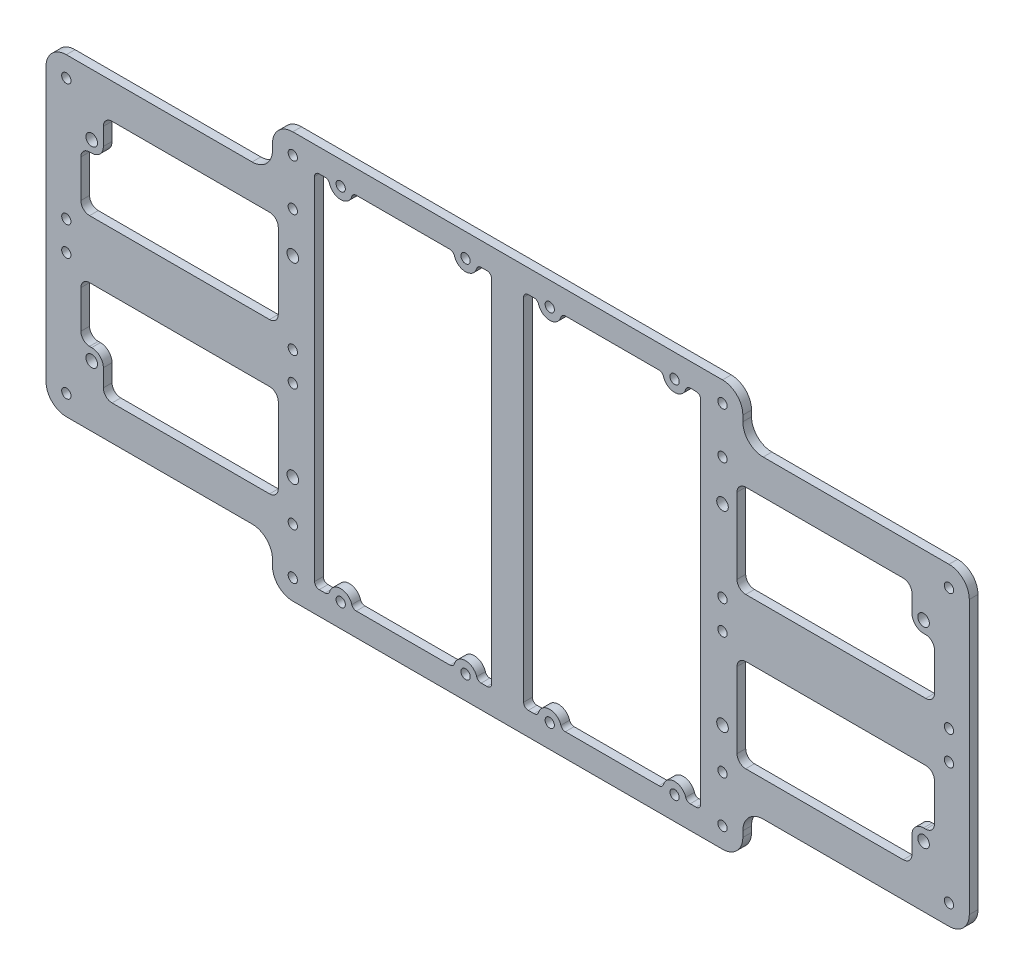
from build123d import *

# Parameters (mm, degrees)
MODEL_R             = 1.6
MODEL_R_2           = 2
BOSS_EXTRUDE1_DEPTH = 3


with BuildPart() as part:
    # Model → Boss-Extrude1 (new body)
    with BuildSketch(Plane.XY):
        with BuildLine():
            Line((-159, -47), (-159, 47))
            ThreePointArc((-159, 47), (-156.949747468, 51.949747468), (-152, 54))
            Line((-152, 54), (-88, 54))
            ThreePointArc((-88, 54), (-83.050252532, 56.050252532), (-81, 61))
            Line((-81, 61), (-81, 63))
            ThreePointArc((-81, 63), (-78.949747468, 67.949747468), (-74, 70))
            Line((-74, 70), (74, 70))
            ThreePointArc((74, 70), (78.949747468, 67.949747468), (81, 63))
            Line((81, 63), (81, 61))
            ThreePointArc((81, 61), (83.050252532, 56.050252532), (88, 54))
            Line((88, 54), (152, 54))
            ThreePointArc((152, 54), (156.949747468, 51.949747468), (159, 47))
            Line((159, 47), (159, -47))
            ThreePointArc((159, -47), (156.949747468, -51.949747468), (152, -54))
            Line((152, -54), (88, -54))
            ThreePointArc((88, -54), (83.050252532, -56.050252532), (81, -61))
            Line((81, -61), (81, -63))
            ThreePointArc((81, -63), (78.949747468, -67.949747468), (74, -70))
            Line((74, -70), (-74, -70))
            ThreePointArc((-74, -70), (-78.949747468, -67.949747468), (-81, -63))
            Line((-81, -63), (-81, -61))
            ThreePointArc((-81, -61), (-83.050252532, -56.050252532), (-88, -54))
            Line((-88, -54), (-152, -54))
            ThreePointArc((-152, -54), (-156.949747468, -51.949747468), (-159, -47))
        make_face()
        with Locations((-57.5, 62)):
            Circle(MODEL_R, mode=Mode.SUBTRACT)
        with Locations((-14.5, 62)):
            Circle(MODEL_R, mode=Mode.SUBTRACT)
        with Locations((-57.5, -62)):
            Circle(MODEL_R, mode=Mode.SUBTRACT)
        with Locations((-14.5, -62)):
            Circle(MODEL_R, mode=Mode.SUBTRACT)
        with Locations((14.5, 62)):
            Circle(MODEL_R, mode=Mode.SUBTRACT)
        with Locations((57.5, 62)):
            Circle(MODEL_R, mode=Mode.SUBTRACT)
        with Locations((14.5, -62)):
            Circle(MODEL_R, mode=Mode.SUBTRACT)
        with Locations((57.5, -62)):
            Circle(MODEL_R, mode=Mode.SUBTRACT)
        with Locations((-152, -47)):
            Circle(MODEL_R, mode=Mode.SUBTRACT)
        with Locations((-152, -5)):
            Circle(MODEL_R, mode=Mode.SUBTRACT)
        with Locations((-74, -47)):
            Circle(MODEL_R, mode=Mode.SUBTRACT)
        with Locations((-74, -5)):
            Circle(MODEL_R, mode=Mode.SUBTRACT)
        with Locations((-152, 47)):
            Circle(MODEL_R, mode=Mode.SUBTRACT)
        with Locations((-152, 5)):
            Circle(MODEL_R, mode=Mode.SUBTRACT)
        with Locations((-74, 47)):
            Circle(MODEL_R, mode=Mode.SUBTRACT)
        with Locations((-74, 5)):
            Circle(MODEL_R, mode=Mode.SUBTRACT)
        with Locations((152, -47)):
            Circle(MODEL_R, mode=Mode.SUBTRACT)
        with Locations((152, -5)):
            Circle(MODEL_R, mode=Mode.SUBTRACT)
        with Locations((74, -47)):
            Circle(MODEL_R, mode=Mode.SUBTRACT)
        with Locations((74, -5)):
            Circle(MODEL_R, mode=Mode.SUBTRACT)
        with Locations((74, 5)):
            Circle(MODEL_R, mode=Mode.SUBTRACT)
        with Locations((152, 47)):
            Circle(MODEL_R, mode=Mode.SUBTRACT)
        with Locations((152, 5)):
            Circle(MODEL_R, mode=Mode.SUBTRACT)
        with Locations((74, 47)):
            Circle(MODEL_R, mode=Mode.SUBTRACT)
        with Locations((-74, 33)):
            Circle(MODEL_R_2, mode=Mode.SUBTRACT)
        with Locations((-74, -33)):
            Circle(MODEL_R_2, mode=Mode.SUBTRACT)
        with Locations((74, 33)):
            Circle(MODEL_R_2, mode=Mode.SUBTRACT)
        with Locations((74, -33)):
            Circle(MODEL_R_2, mode=Mode.SUBTRACT)
        with Locations((-143.25, 33)):
            Circle(MODEL_R_2, mode=Mode.SUBTRACT)
        with Locations((-143.25, -33)):
            Circle(MODEL_R_2, mode=Mode.SUBTRACT)
        with Locations((143.25, 33)):
            Circle(MODEL_R_2, mode=Mode.SUBTRACT)
        with Locations((143.25, -33)):
            Circle(MODEL_R_2, mode=Mode.SUBTRACT)
        with Locations((-74, 63)):
            Circle(MODEL_R, mode=Mode.SUBTRACT)
        with Locations((74, 63)):
            Circle(MODEL_R, mode=Mode.SUBTRACT)
        with Locations((-74, -63)):
            Circle(MODEL_R, mode=Mode.SUBTRACT)
        with Locations((74, -63)):
            Circle(MODEL_R, mode=Mode.SUBTRACT)
        with BuildLine():
            Line((-62.866563146, 62), (-64.9, 62))
            ThreePointArc((-64.9, 62), (-66.03137085, 61.53137085), (-66.5, 60.4))
            Line((-66.5, 60.4), (-66.5, -60.4))
            ThreePointArc((-66.5, -60.4), (-66.03137085, -61.53137085), (-64.9, -62))
            Line((-64.9, -62), (-62.866563146, -62))
            ThreePointArc((-62.866563146, -62), (-61.910380259, -61.682853961), (-61.33325939, -60.857142857))
            ThreePointArc((-61.33325939, -60.857142857), (-57.5, -58), (-53.66674061, -60.857142857))
            ThreePointArc((-53.66674061, -60.857142857), (-53.089619741, -61.682853961), (-52.133436854, -62))
            Line((-52.133436854, -62), (-19.866563146, -62))
            ThreePointArc((-19.866563146, -62), (-18.910380259, -61.682853961), (-18.33325939, -60.857142857))
            ThreePointArc((-18.33325939, -60.857142857), (-14.5, -58), (-10.66674061, -60.857142857))
            ThreePointArc((-10.66674061, -60.857142857), (-10.089619741, -61.682853961), (-9.133436854, -62))
            Line((-9.133436854, -62), (-7.1, -62))
            ThreePointArc((-7.1, -62), (-5.96862915, -61.53137085), (-5.5, -60.4))
            Line((-5.5, -60.4), (-5.5, 60.4))
            ThreePointArc((-5.5, 60.4), (-5.96862915, 61.53137085), (-7.1, 62))
            Line((-7.1, 62), (-9.133436854, 62))
            ThreePointArc((-9.133436854, 62), (-10.089619741, 61.682853961), (-10.66674061, 60.857142857))
            ThreePointArc((-10.66674061, 60.857142857), (-14.5, 58), (-18.33325939, 60.857142857))
            ThreePointArc((-18.33325939, 60.857142857), (-18.910380259, 61.682853961), (-19.866563146, 62))
            Line((-19.866563146, 62), (-52.133436854, 62))
            ThreePointArc((-52.133436854, 62), (-53.089619741, 61.682853961), (-53.66674061, 60.857142857))
            ThreePointArc((-53.66674061, 60.857142857), (-57.5, 58), (-61.33325939, 60.857142857))
            ThreePointArc((-61.33325939, 60.857142857), (-61.910380259, 61.682853961), (-62.866563146, 62))
        make_face(mode=Mode.SUBTRACT)
        with BuildLine():
            Line((9.133436854, 62), (7.1, 62))
            ThreePointArc((7.1, 62), (5.96862915, 61.53137085), (5.5, 60.4))
            Line((5.5, 60.4), (5.5, -60.4))
            ThreePointArc((5.5, -60.4), (5.96862915, -61.53137085), (7.1, -62))
            Line((7.1, -62), (9.133436854, -62))
            ThreePointArc((9.133436854, -62), (10.089619741, -61.682853961), (10.66674061, -60.857142857))
            ThreePointArc((10.66674061, -60.857142857), (14.5, -58), (18.33325939, -60.857142857))
            ThreePointArc((18.33325939, -60.857142857), (18.910380259, -61.682853961), (19.866563146, -62))
            Line((19.866563146, -62), (52.133436854, -62))
            ThreePointArc((52.133436854, -62), (53.089619741, -61.682853961), (53.66674061, -60.857142857))
            ThreePointArc((53.66674061, -60.857142857), (57.5, -58), (61.33325939, -60.857142857))
            ThreePointArc((61.33325939, -60.857142857), (61.910380259, -61.682853961), (62.866563146, -62))
            Line((62.866563146, -62), (64.9, -62))
            ThreePointArc((64.9, -62), (66.03137085, -61.53137085), (66.5, -60.4))
            Line((66.5, -60.4), (66.5, 60.4))
            ThreePointArc((66.5, 60.4), (66.03137085, 61.53137085), (64.9, 62))
            Line((64.9, 62), (62.866563146, 62))
            ThreePointArc((62.866563146, 62), (61.910380259, 61.682853961), (61.33325939, 60.857142857))
            ThreePointArc((61.33325939, 60.857142857), (57.5, 58), (53.66674061, 60.857142857))
            ThreePointArc((53.66674061, 60.857142857), (53.089619741, 61.682853961), (52.133436854, 62))
            Line((52.133436854, 62), (19.866563146, 62))
            ThreePointArc((19.866563146, 62), (18.910380259, 61.682853961), (18.33325939, 60.857142857))
            ThreePointArc((18.33325939, 60.857142857), (14.5, 58), (10.66674061, 60.857142857))
            ThreePointArc((10.66674061, 60.857142857), (10.089619741, 61.682853961), (9.133436854, 62))
        make_face(mode=Mode.SUBTRACT)
        with BuildLine():
            Line((-136.25, -42), (-82, -42))
            ThreePointArc((-82, -42), (-79.878679656, -41.121320344), (-79, -39))
            Line((-79, -39), (-79, -13))
            ThreePointArc((-79, -13), (-79.878679656, -10.878679656), (-82, -10))
            Line((-82, -10), (-144, -10))
            ThreePointArc((-144, -10), (-146.121320344, -10.878679656), (-147, -13))
            Line((-147, -13), (-147, -26))
            ThreePointArc((-147, -26), (-146.121320344, -28.121320344), (-144, -29))
            Line((-144, -29), (-143.25, -29))
            ThreePointArc((-143.25, -29), (-140.421572875, -30.171572875), (-139.25, -33))
            Line((-139.25, -33), (-139.25, -39))
            ThreePointArc((-139.25, -39), (-138.371320344, -41.121320344), (-136.25, -42))
        make_face(mode=Mode.SUBTRACT)
        with BuildLine():
            Line((-136.25, 42), (-82, 42))
            ThreePointArc((-82, 42), (-79.878679656, 41.121320344), (-79, 39))
            Line((-79, 39), (-79, 13))
            ThreePointArc((-79, 13), (-79.878679656, 10.878679656), (-82, 10))
            Line((-82, 10), (-144, 10))
            ThreePointArc((-144, 10), (-146.121320344, 10.878679656), (-147, 13))
            Line((-147, 13), (-147, 26))
            ThreePointArc((-147, 26), (-146.121320344, 28.121320344), (-144, 29))
            Line((-144, 29), (-143.25, 29))
            ThreePointArc((-143.25, 29), (-140.421572875, 30.171572875), (-139.25, 33))
            Line((-139.25, 33), (-139.25, 39))
            ThreePointArc((-139.25, 39), (-138.371320344, 41.121320344), (-136.25, 42))
        make_face(mode=Mode.SUBTRACT)
        with BuildLine():
            Line((136.25, -42), (82, -42))
            ThreePointArc((82, -42), (79.878679656, -41.121320344), (79, -39))
            Line((79, -39), (79, -13))
            ThreePointArc((79, -13), (79.878679656, -10.878679656), (82, -10))
            Line((82, -10), (144, -10))
            ThreePointArc((144, -10), (146.121320344, -10.878679656), (147, -13))
            Line((147, -13), (147, -26))
            ThreePointArc((147, -26), (146.121320344, -28.121320344), (144, -29))
            Line((144, -29), (143.25, -29))
            ThreePointArc((143.25, -29), (140.421572875, -30.171572875), (139.25, -33))
            Line((139.25, -33), (139.25, -39))
            ThreePointArc((139.25, -39), (138.371320344, -41.121320344), (136.25, -42))
        make_face(mode=Mode.SUBTRACT)
        with BuildLine():
            Line((136.25, 42), (82, 42))
            ThreePointArc((82, 42), (79.878679656, 41.121320344), (79, 39))
            Line((79, 39), (79, 13))
            ThreePointArc((79, 13), (79.878679656, 10.878679656), (82, 10))
            Line((82, 10), (144, 10))
            ThreePointArc((144, 10), (146.121320344, 10.878679656), (147, 13))
            Line((147, 13), (147, 26))
            ThreePointArc((147, 26), (146.121320344, 28.121320344), (144, 29))
            Line((144, 29), (143.25, 29))
            ThreePointArc((143.25, 29), (140.421572875, 30.171572875), (139.25, 33))
            Line((139.25, 33), (139.25, 39))
            ThreePointArc((139.25, 39), (138.371320344, 41.121320344), (136.25, 42))
        make_face(mode=Mode.SUBTRACT)
    extrude(amount=BOSS_EXTRUDE1_DEPTH)


solid = part.part
